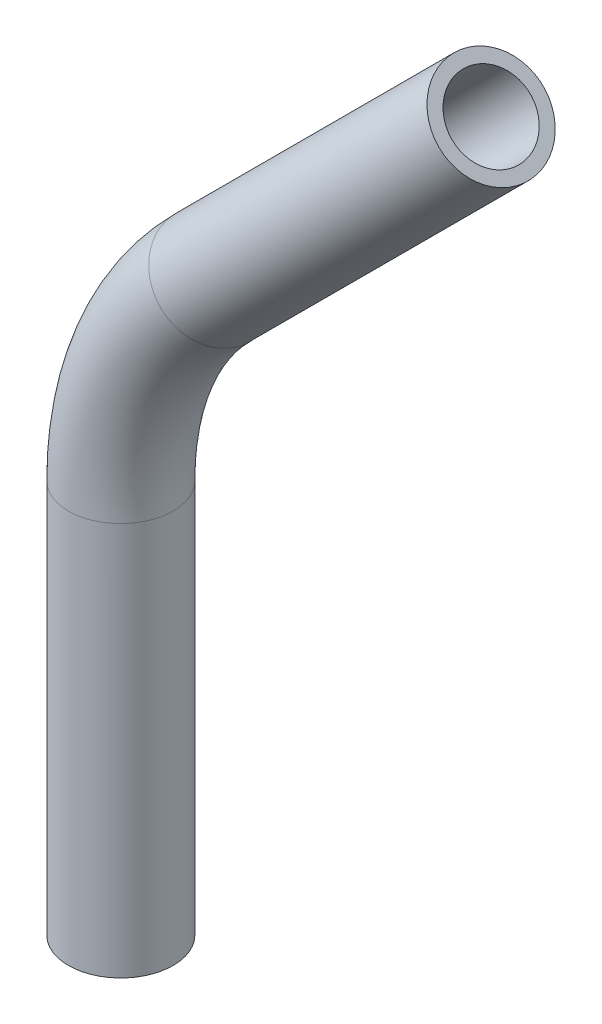
from build123d import *

# Parameters (mm, degrees)
SKETCH2_R   = 4
SKETCH2_R_2 = 3


with BuildPart() as part:
    # Sweep1: sweep along a path in Sketch1
    with BuildLine(Plane.XY) as sweep1_path:
        Line((0, 0), (0, 30.058874503))
        ThreePointArc((0, 30.058874503), (1.82689122, 39.24327688), (7.029437252, 47.029437252))
        Line((7.029437252, 47.029437252), (28.284271247, 68.284271247))
    # Sketch2 → Sweep1 (sweep)
    with BuildSketch(Plane(origin=(0, 0, 0), x_dir=(1, 0, 0), z_dir=(0, 1, 0))):
        Circle(SKETCH2_R)
        Circle(SKETCH2_R_2, mode=Mode.SUBTRACT)
    sweep(path=sweep1_path.line)


solid = part.part
